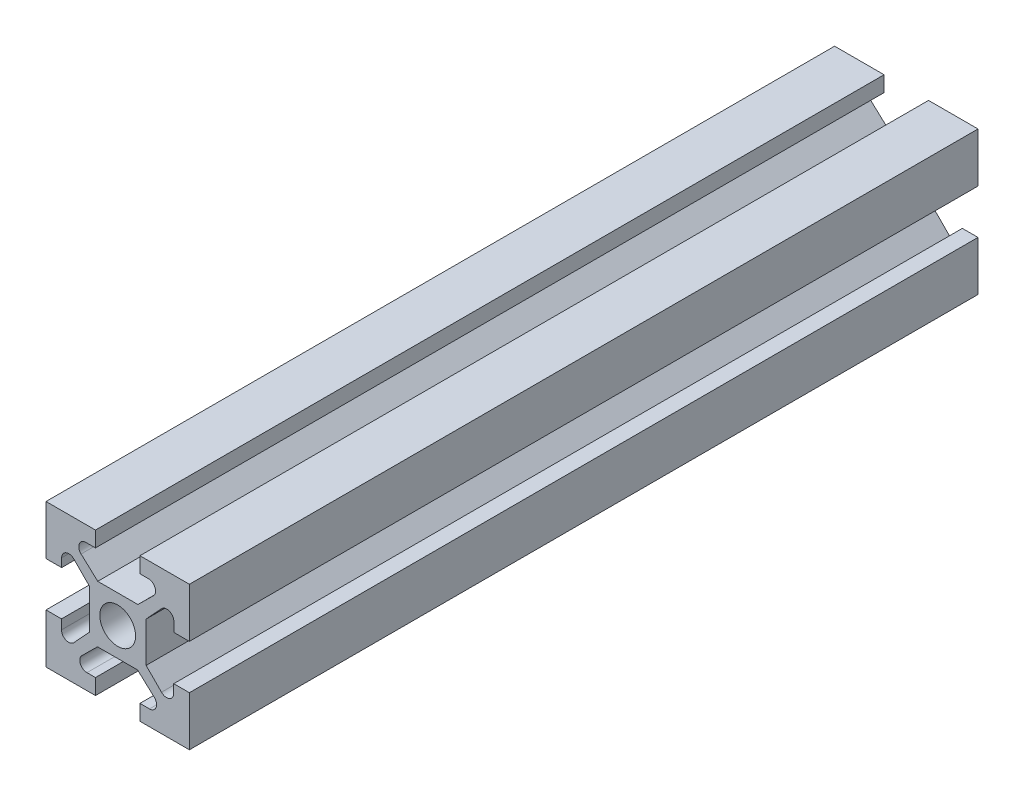
from build123d import *

# Parameters (mm, degrees)
SKETCH2_R           = 2.5
BOSS_EXTRUDE1_DEPTH = 110


with BuildPart() as part:
    # Sketch2 → Boss-Extrude1 (new body)
    with BuildSketch(Plane.XY):
        with BuildLine():
            Line((-10, -10), (-3.1, -10))
            Line((-3.1, -10), (-3.1, -7.81857447))
            Line((-3.1, -7.81857447), (-4.285374034, -7.81857447))
            ThreePointArc((-4.285374034, -7.81857447), (-5.210402021, -7.198473435), (-4.988208383, -6.107220917))
            Line((-4.988208383, -6.107220917), (-2.819718275, -3.96470075))
            Line((-2.819718275, -3.96470075), (0, -3.96470075))
            Line((0, -3.96470075), (2.782738033, -3.96470075))
            Line((2.782738033, -3.96470075), (5.105242131, -6.103332486))
            ThreePointArc((5.105242131, -6.103332486), (5.359419929, -7.202533996), (4.427854938, -7.838959152))
            Line((4.427854938, -7.838959152), (3.1, -7.838959152))
            Line((3.1, -7.838959152), (3.1, -10))
            Line((3.1, -10), (10, -10))
            Line((10, -10), (10, -3.1))
            Line((10, -3.1), (7.81857447, -3.1))
            Line((7.81857447, -3.1), (7.81857447, -4.285374034))
            ThreePointArc((7.81857447, -4.285374034), (7.198473435, -5.210402021), (6.107220917, -4.988208383))
            Line((6.107220917, -4.988208383), (3.96470075, -2.819718275))
            Line((3.96470075, -2.819718275), (3.96470075, 0))
            Line((3.96470075, 0), (3.96470075, 2.782738033))
            Line((3.96470075, 2.782738033), (6.103332486, 5.105242131))
            ThreePointArc((6.103332486, 5.105242131), (7.202533996, 5.359419929), (7.838959152, 4.427854938))
            Line((7.838959152, 4.427854938), (7.838959152, 3.1))
            Line((7.838959152, 3.1), (10, 3.1))
            Line((10, 3.1), (10, 10))
            Line((10, 10), (3.1, 10))
            Line((3.1, 10), (3.1, 7.81857447))
            Line((3.1, 7.81857447), (4.285374034, 7.81857447))
            ThreePointArc((4.285374034, 7.81857447), (5.210402021, 7.198473435), (4.988208383, 6.107220917))
            Line((4.988208383, 6.107220917), (2.819718275, 3.96470075))
            Line((2.819718275, 3.96470075), (0, 3.96470075))
            Line((0, 3.96470075), (-2.782738033, 3.96470075))
            Line((-2.782738033, 3.96470075), (-5.105242131, 6.103332486))
            ThreePointArc((-5.105242131, 6.103332486), (-5.359419929, 7.202533996), (-4.427854938, 7.838959152))
            Line((-4.427854938, 7.838959152), (-3.1, 7.838959152))
            Line((-3.1, 7.838959152), (-3.1, 10))
            Line((-3.1, 10), (-10, 10))
            Line((-10, 10), (-10, 3.1))
            Line((-10, 3.1), (-7.81857447, 3.1))
            Line((-7.81857447, 3.1), (-7.81857447, 4.285374034))
            ThreePointArc((-7.81857447, 4.285374034), (-7.198473435, 5.210402021), (-6.107220917, 4.988208383))
            Line((-6.107220917, 4.988208383), (-3.96470075, 2.819718275))
            Line((-3.96470075, 2.819718275), (-3.96470075, 0))
            Line((-3.96470075, 0), (-3.96470075, -2.782738033))
            Line((-3.96470075, -2.782738033), (-6.103332486, -5.105242131))
            ThreePointArc((-6.103332486, -5.105242131), (-7.202533996, -5.359419929), (-7.838959152, -4.427854938))
            Line((-7.838959152, -4.427854938), (-7.838959152, -3.1))
            Line((-7.838959152, -3.1), (-10, -3.1))
            Line((-10, -3.1), (-10, -10))
        make_face()
        Circle(SKETCH2_R, mode=Mode.SUBTRACT)
    extrude(amount=BOSS_EXTRUDE1_DEPTH)


solid = part.part
